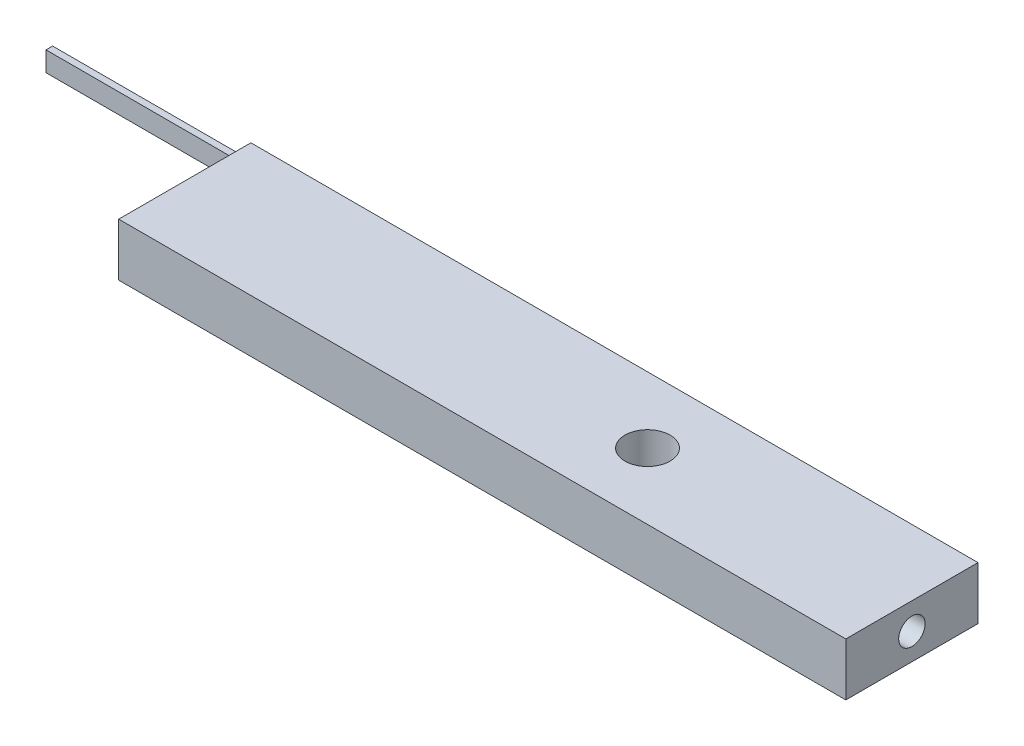
from build123d import *

# Parameters (mm, degrees)
SKETCH1_W           = 550
SKETCH1_H           = 100
SKETCH1_R           = 17.084029422
BOSS_EXTRUDE1_DEPTH = 40
SKETCH2_R           = 10
CUT_EXTRUDE1_DEPTH  = 114
SKETCH3_W           = 150
SKETCH3_H           = 15
BOSS_EXTRUDE2_DEPTH = 5


with BuildPart() as part:
    # Sketch1 → Boss-Extrude1 (new body)
    with BuildSketch(Plane(origin=(0, 0, 0), x_dir=(1, 0, 0), z_dir=(0, 1, 0))):
        with Locations((-156.408850848, -15.066043846)):
            Rectangle(SKETCH1_W, SKETCH1_H)
        with Locations(Location((-81.408850848, -15.066043846, 0), (0, 0, 270))):
            Circle(SKETCH1_R, mode=Mode.SUBTRACT)
    extrude(amount=BOSS_EXTRUDE1_DEPTH)

    # Sketch2 → Cut-Extrude1 (cut)
    with BuildSketch(Plane(origin=(118.591149152, 0, 0), x_dir=(0, 0, -1), z_dir=(1, 0, 0))):
        with Locations((-15.066043846, 20)):
            Circle(SKETCH2_R)
    extrude(amount=-CUT_EXTRUDE1_DEPTH, mode=Mode.SUBTRACT)


with BuildPart() as body_2:
    # Sketch3 → Boss-Extrude2 (new body)
    with BuildSketch(Plane(origin=(0, 0, -34.933956154), x_dir=(-1, 0, 0), z_dir=(0, 0, -1))):
        with Locations((506.408850848, 20.90171756)):
            Rectangle(SKETCH3_W, SKETCH3_H)
    extrude(amount=-BOSS_EXTRUDE2_DEPTH)


solid = Compound([part.part, body_2.part])
